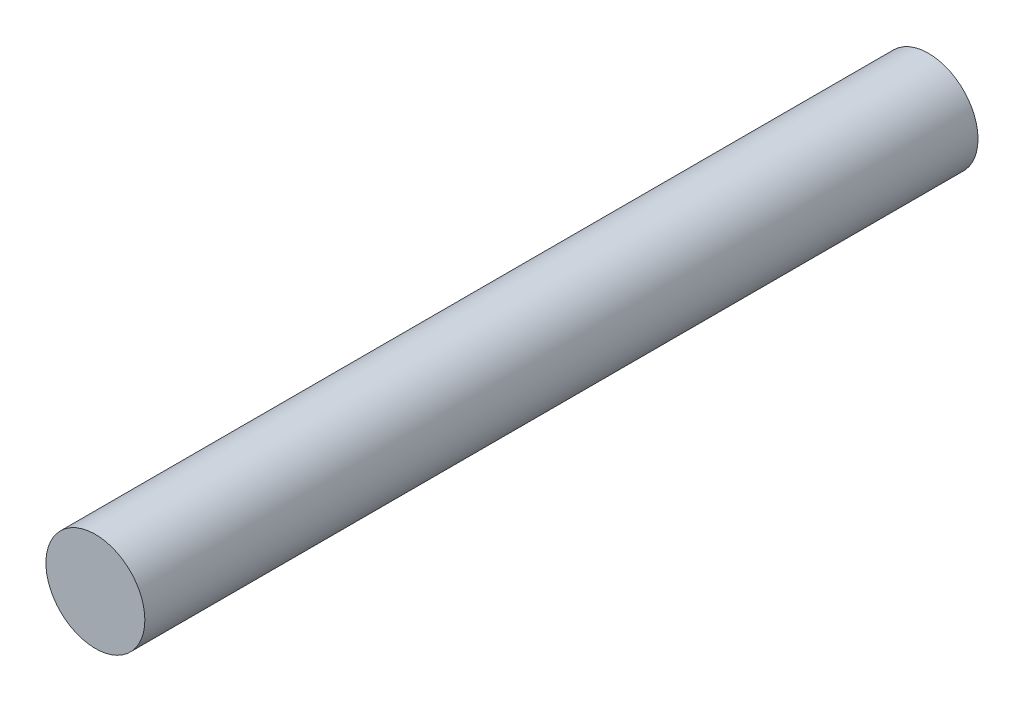
from build123d import *

# Parameters (mm, degrees)
SKETCH1_R           = 1.425
BOSS_EXTRUDE1_DEPTH = 24


with BuildPart() as part:
    # Sketch1 → Boss-Extrude1 (new body)
    with BuildSketch(Plane.XY):
        Circle(SKETCH1_R)
    extrude(amount=BOSS_EXTRUDE1_DEPTH)


solid = part.part
